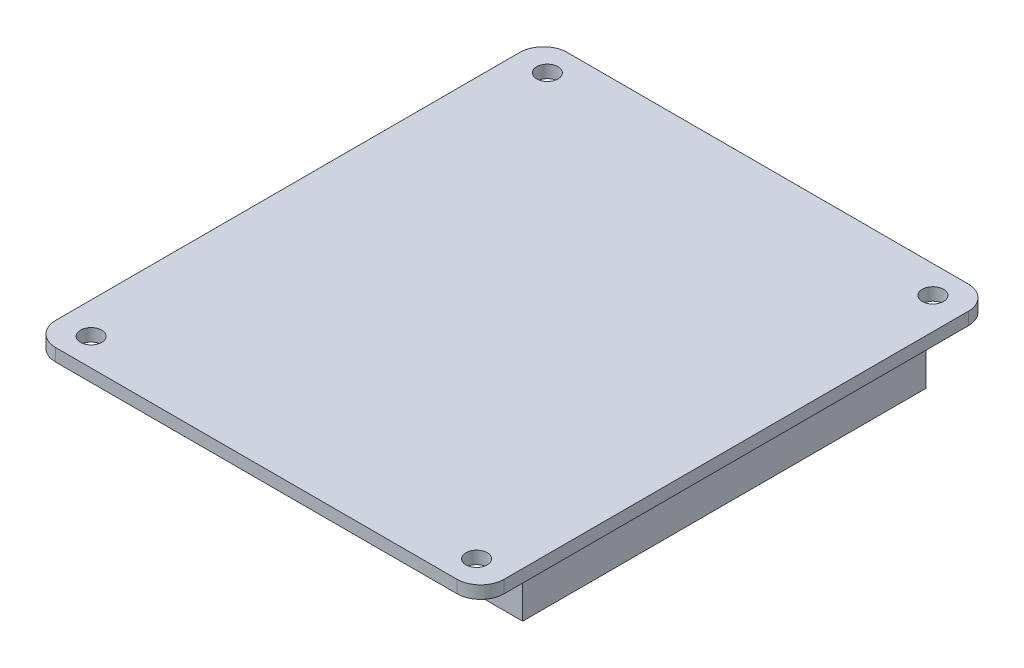
from build123d import *

# Parameters (mm, degrees)
BOSS_EXTRUDE1_DEPTH = 1.6
SKETCH2_R           = 1.35
CUT_EXTRUDE1_DEPTH  = 87.467103571
SKETCH3_W           = 5
SKETCH3_H           = 51.3
BOSS_EXTRUDE2_DEPTH = 5.7


with BuildPart() as part:
    # Sketch1 → Boss-Extrude1 (new body)
    with BuildSketch(Plane(origin=(0, 0, 0), x_dir=(1, 0, 0), z_dir=(0, 1, 0))):
        with BuildLine():
            Line((3, 0), (54, 0))
            ThreePointArc((54, 0), (56.121320344, 0.878679656), (57, 3))
            Line((57, 3), (57, 62))
            ThreePointArc((57, 62), (56.121320344, 64.121320344), (54, 65))
            Line((54, 65), (3, 65))
            ThreePointArc((3, 65), (0.878679656, 64.121320344), (0, 62))
            Line((0, 62), (0, 3))
            ThreePointArc((0, 3), (0.878679656, 0.878679656), (3, 0))
        make_face()
    extrude(amount=BOSS_EXTRUDE1_DEPTH)

    # Sketch2 → Cut-Extrude1 (cut, through all)
    with BuildSketch(Plane(origin=(0, 1.6, 0), x_dir=(1, 0, 0), z_dir=(0, 1, 0))):
        with Locations(Location((4, 61.5, 0), (0, 0, 270))):
            Circle(SKETCH2_R)
        with Locations(Location((53, 61.5, 0), (0, 0, 270))):
            Circle(SKETCH2_R)
        with Locations(Location((53, 3.5, 0), (0, 0, 270))):
            Circle(SKETCH2_R)
        with Locations(Location((4, 3.5, 0), (0, 0, 270))):
            Circle(SKETCH2_R)
    extrude(amount=-CUT_EXTRUDE1_DEPTH, mode=Mode.SUBTRACT)

    # Sketch3 → Boss-Extrude2 (add)
    with BuildSketch(Plane.XZ):
        with Locations((53, -32.5)):
            Rectangle(SKETCH3_W, SKETCH3_H)
    extrude(amount=BOSS_EXTRUDE2_DEPTH)


solid = part.part
